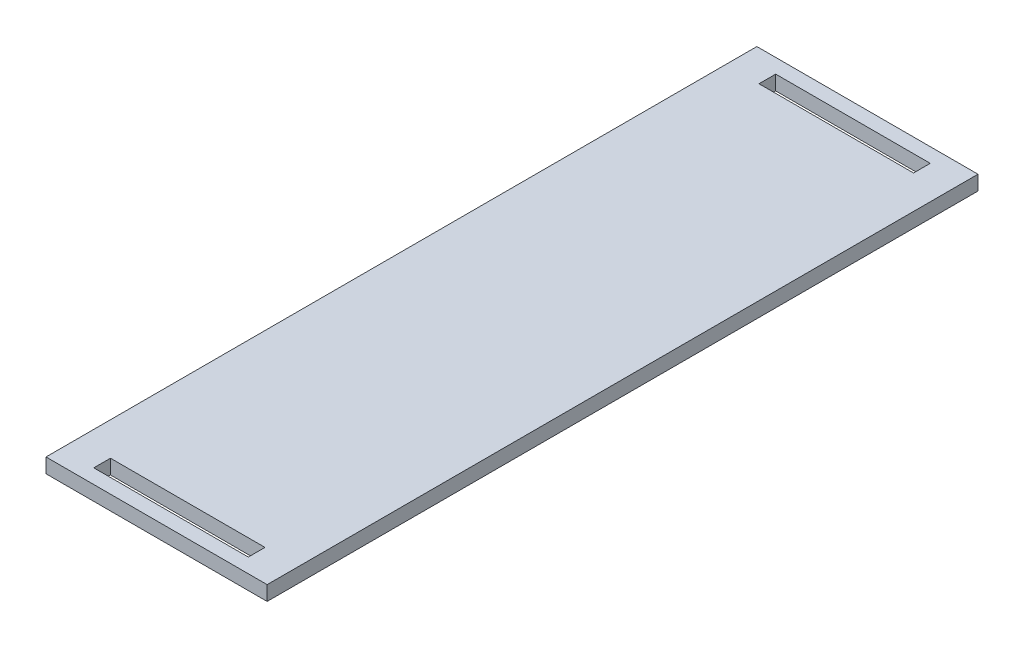
from build123d import *

# Parameters (mm, degrees)
SKETCH1_W           = 45.4336912
SKETCH1_H           = 146.05
SKETCH1_W_2         = 31.75
SKETCH1_H_2         = 3.429
BOSS_EXTRUDE1_DEPTH = 2.9972


with BuildPart() as part:
    # Sketch1 → Boss-Extrude1 (new body)
    with BuildSketch(Plane(origin=(0, 0, 0), x_dir=(1, 0, 0), z_dir=(0, 1, 0))):
        Rectangle(SKETCH1_W, SKETCH1_H)
        with Locations((0, 68.3387)):
            Rectangle(SKETCH1_W_2, SKETCH1_H_2, mode=Mode.SUBTRACT)
        with Locations((0, -68.3387)):
            Rectangle(SKETCH1_W_2, SKETCH1_H_2, mode=Mode.SUBTRACT)
    extrude(amount=BOSS_EXTRUDE1_DEPTH)


solid = part.part
